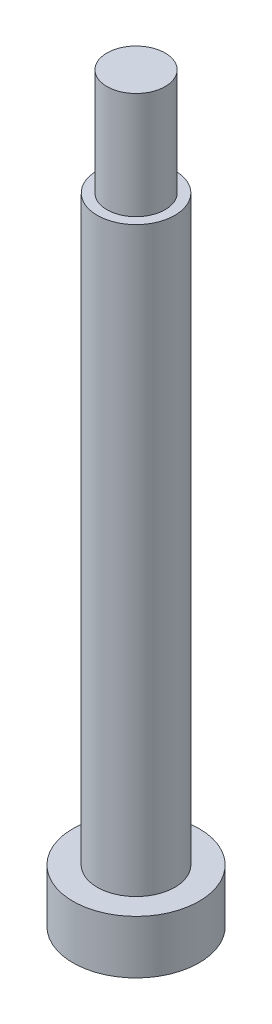
from build123d import *

# Parameters (mm, degrees)
SKETCH_1_R      = 4
EXTRUDE_1_DEPTH = 60
SKETCH_2_R      = 3
EXTRUDE_2_DEPTH = 11
SKETCH_3_R      = 6.5
EXTRUDE_3_DEPTH = 5.5


with BuildPart() as part:
    # 草图1 → 凸台-拉伸1 (new body)
    with BuildSketch(Plane(origin=(0, 0, 0), x_dir=(1, 0, 0), z_dir=(0, 1, 0))):
        with Locations(Location((0, 0, 0), (0, 0, 270))):
            Circle(SKETCH_1_R)
    extrude(amount=EXTRUDE_1_DEPTH)

    # 草图2 → 凸台-拉伸2 (add)
    with BuildSketch(Plane(origin=(0, 60, 0), x_dir=(1, 0, 0), z_dir=(0, 1, 0))):
        with Locations(Location((0, 0, 0), (0, 0, 270))):
            Circle(SKETCH_2_R)
    extrude(amount=EXTRUDE_2_DEPTH)

    # 草图3 → 凸台-拉伸3 (add)
    with BuildSketch(Plane.XZ):
        with Locations(Location((0, 0, 0), (0, 0, 270))):
            Circle(SKETCH_3_R)
    extrude(amount=EXTRUDE_3_DEPTH)


solid = part.part
